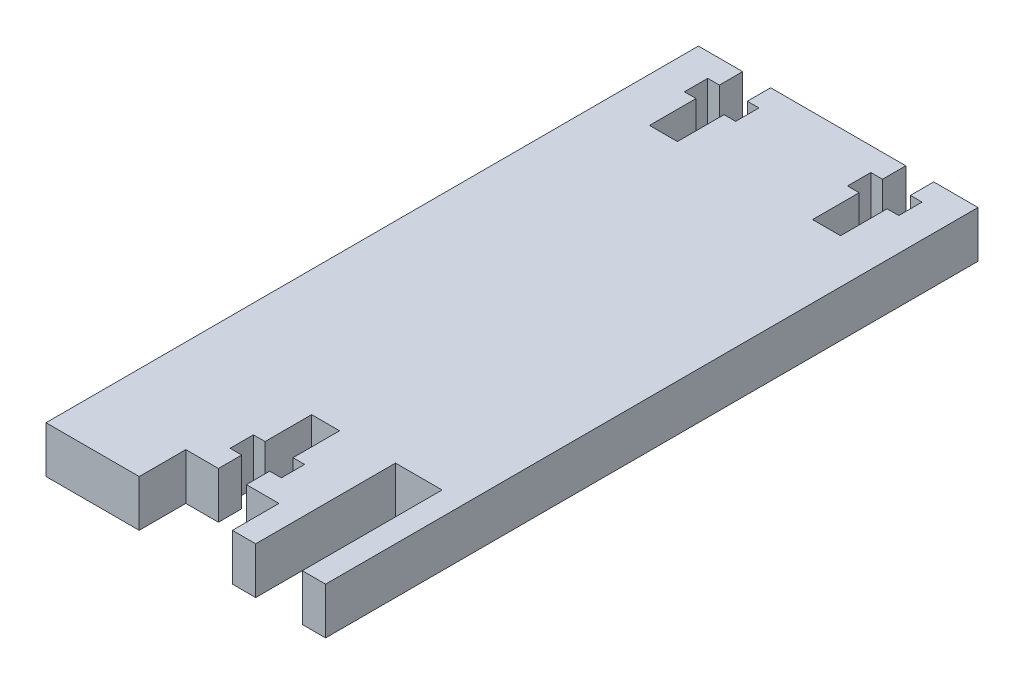
from build123d import *

# Parameters (mm, degrees)
SKETCH1_W           = 30
SKETCH1_H           = 5
BOSS_EXTRUDE1_DEPTH = 65
CUT_EXTRUDE1_DEPTH  = 81.015043264
SKETCH3_W           = 10
SKETCH3_H           = 5
BOSS_EXTRUDE2_DEPTH = 5
SKETCH4_W           = 1.25
SKETCH4_H           = 2.5
SKETCH4_W_2         = 3
SKETCH4_H_2         = 5
CUT_EXTRUDE2_DEPTH  = 85.127327002
SKETCH5_W           = 5
SKETCH5_H           = 15
CUT_EXTRUDE3_DEPTH  = 85.127327002


with BuildPart() as part:
    # Sketch1 → Boss-Extrude1 (new body)
    with BuildSketch(Plane.XY):
        with Locations((31.394042166, -137)):
            Rectangle(SKETCH1_W, SKETCH1_H)
    extrude(amount=BOSS_EXTRUDE1_DEPTH)

    # Sketch2 → Cut-Extrude1 (cut, through all)
    with BuildSketch(Plane.XZ.offset(139.5)):
        Polygon((21.144042166, 10), (24.144042166, 10), (24.144042166, 5), (25.394042166, 5), (25.394042166, 2.5), (24.144042166, 2.5), (24.144042166, 0), (21.144042166, 0), (21.144042166, 2.5), (19.894042166, 2.5), (19.894042166, 5), (21.144042166, 5), align=None)
        Polygon((41.644042166, 10), (38.644042166, 10), (38.644042166, 5), (37.394042166, 5), (37.394042166, 2.5), (38.644042166, 2.5), (38.644042166, 0), (41.644042166, 0), (41.644042166, 2.5), (42.894042166, 2.5), (42.894042166, 5), (41.644042166, 5), align=None)
    extrude(amount=-CUT_EXTRUDE1_DEPTH, mode=Mode.SUBTRACT)

    # Sketch3 → Boss-Extrude2 (add)
    with BuildSketch(Plane.XZ.offset(139.5)):
        with Locations((21.394042166, 67.5)):
            Rectangle(SKETCH3_W, SKETCH3_H)
        with Locations((41.394042166, 67.5)):
            Rectangle(SKETCH3_W, SKETCH3_H)
    extrude(amount=-BOSS_EXTRUDE2_DEPTH)

    # Sketch4 → Cut-Extrude2 (cut, through all)
    with BuildSketch(Plane.XZ.offset(139.5)):
        with Locations((29.269042166, 61.25)):
            Rectangle(SKETCH4_W, SKETCH4_H)
        with Locations((31.394042166, 63.75)):
            Rectangle(SKETCH4_W_2, SKETCH4_H)
        with Locations((31.394042166, 61.25)):
            Rectangle(SKETCH4_W_2, SKETCH4_H)
        with Locations((31.394042166, 57.5)):
            Rectangle(SKETCH4_W_2, SKETCH4_H_2)
        with Locations((33.519042166, 61.25)):
            Rectangle(SKETCH4_W, SKETCH4_H)
    extrude(amount=-CUT_EXTRUDE2_DEPTH, mode=Mode.SUBTRACT)

    # Sketch5 → Cut-Extrude3 (cut, through all)
    with BuildSketch(Plane(origin=(0, -134.5, 0), x_dir=(1, 0, 0), z_dir=(0, 1, 0))):
        with Locations((41.394042166, -62.5)):
            Rectangle(SKETCH5_W, SKETCH5_H)
    extrude(amount=-CUT_EXTRUDE3_DEPTH, mode=Mode.SUBTRACT)


solid = part.part
